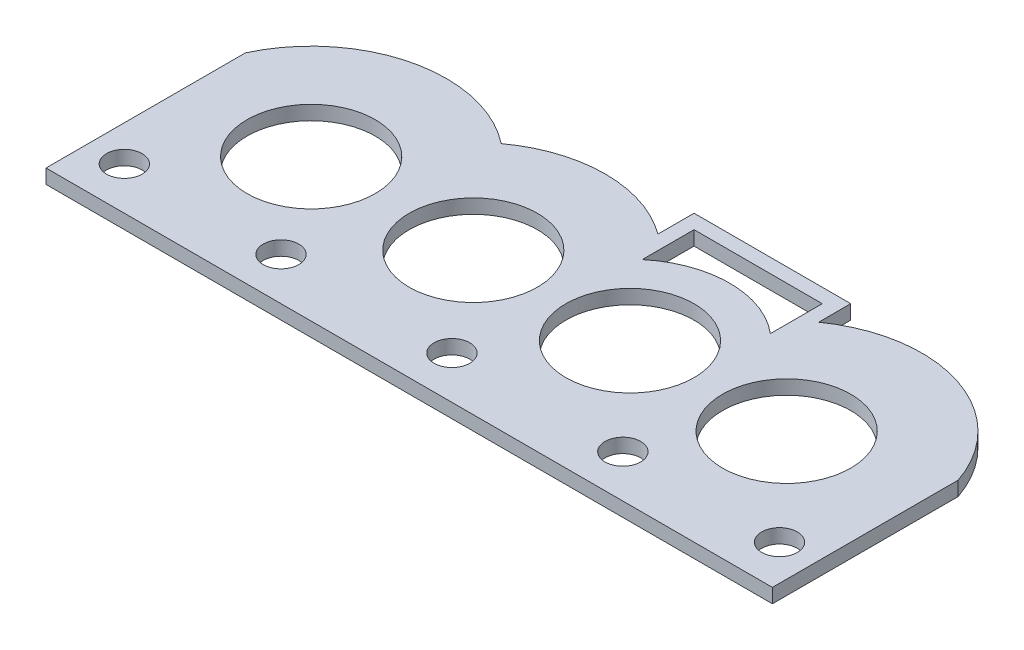
from build123d import *

# Parameters (mm, degrees)
SKETCH1_R           = 1.25
SKETCH1_R_2         = 4.5
BOSS_EXTRUDE1_DEPTH = 1


with BuildPart() as part:
    # Sketch1 → Boss-Extrude1 (new body)
    with BuildSketch(Plane(origin=(0, 0, 0), x_dir=(1, 0, 0), z_dir=(0, 1, 0))):
        with BuildLine():
            ThreePointArc((25.5, 17.461803162), (19.998907706, 19.269762955), (14.498241643, 17.46050678))
            ThreePointArc((14.498241643, 17.46050678), (6.411295647, 19.240430542), (0, 14))
            Line((0, 14), (0, 0))
            Line((0, 0), (51, 0))
            Line((51, 0), (51, 13.041381265))
            ThreePointArc((51, 13.041381265), (44.93185624, 19.036272406), (36.5, 17.745966692))
            Line((36.5, 17.745966692), (36.5, 20))
            Line((36.5, 20), (25.5, 20))
            Line((25.5, 20), (25.5, 17.461803162))
        make_face()
        with Locations(Location((48.5, 3, 0), (0, 0, 270))):
            Circle(SKETCH1_R, mode=Mode.SUBTRACT)
        with Locations(Location((37.5, 3, 0), (0, 0, 270))):
            Circle(SKETCH1_R, mode=Mode.SUBTRACT)
        with Locations(Location((25.5, 3, 0), (0, 0, 270))):
            Circle(SKETCH1_R, mode=Mode.SUBTRACT)
        with Locations(Location((8.61684397, 10, 0), (0, 0, 270))):
            Circle(SKETCH1_R_2, mode=Mode.SUBTRACT)
        with Locations(Location((20, 10, 0), (0, 0, 270))):
            Circle(SKETCH1_R_2, mode=Mode.SUBTRACT)
        with Locations(Location((31, 10, 0), (0, 0, 270))):
            Circle(SKETCH1_R_2, mode=Mode.SUBTRACT)
        with Locations(Location((42, 10, 0), (0, 0, 270))):
            Circle(SKETCH1_R_2, mode=Mode.SUBTRACT)
        with Locations(Location((2.5, 3, 0), (0, 0, 270))):
            Circle(SKETCH1_R, mode=Mode.SUBTRACT)
        with Locations(Location((13.5, 3, 0), (0, 0, 270))):
            Circle(SKETCH1_R, mode=Mode.SUBTRACT)
        with BuildLine():
            Line((35.5, 19), (35.5, 15.361902647))
            ThreePointArc((35.5, 15.361902647), (31, 17), (26.5, 15.361902647))
            Line((26.5, 15.361902647), (26.5, 19))
            Line((26.5, 19), (35.5, 19))
        make_face(mode=Mode.SUBTRACT)
    extrude(amount=BOSS_EXTRUDE1_DEPTH)


solid = part.part
